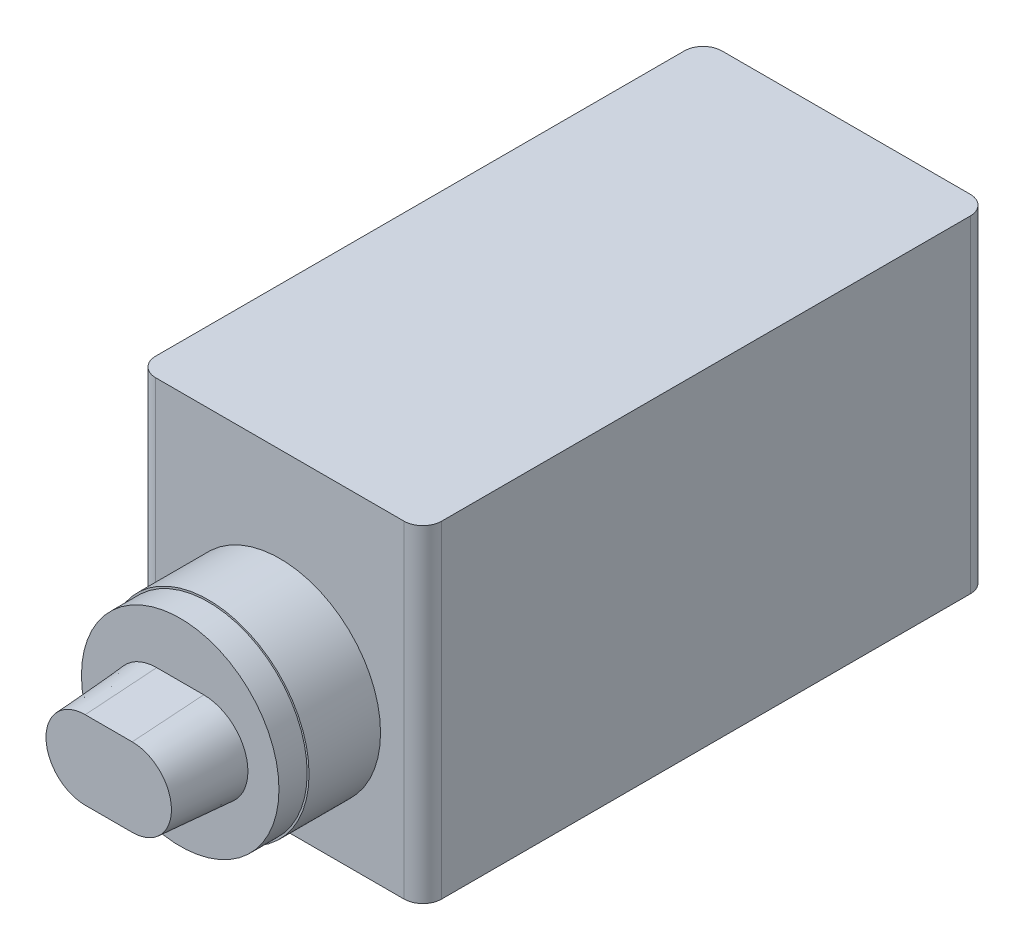
from build123d import *

# Parameters (mm, degrees)
SKETCH1_W           = 15.2
SKETCH1_H           = 30.1
BOSS_EXTRUDE1_DEPTH = 17.4
FILLET1_R           = 1
SKETCH3_R           = 5.35
BOSS_EXTRUDE2_DEPTH = 3.8
SKETCH4_R           = 5.25
BOSS_EXTRUDE3_DEPTH = 1.5
BOSS_EXTRUDE4_DEPTH = 3.8
BOSS_EXTRUDE4_TAPER = 4


with BuildPart() as part:
    # Sketch1 → Boss-Extrude1 (new body)
    with BuildSketch(Plane(origin=(0, 0, 0), x_dir=(1, 0, 0), z_dir=(0, 1, 0))):
        Rectangle(SKETCH1_W, SKETCH1_H)
    extrude(amount=BOSS_EXTRUDE1_DEPTH)

    # Fillet1
    fillet1_edges = [part.edges().sort_by_distance(p)[0] for p in [
        (-7.6, 8.7, -15.05),
        (7.6, 8.7, -15.05),
        (7.6, 8.7, 15.05),
        (-7.6, 8.7, 15.05),
    ]]
    fillet(fillet1_edges, radius=FILLET1_R)

    # Sketch3 → Boss-Extrude2 (add)
    with BuildSketch(Plane.XY.offset(15.05)):
        with Locations(Location((0, 7.030745518, 0), (0, 0, 180))):
            Circle(SKETCH3_R)
    extrude(amount=BOSS_EXTRUDE2_DEPTH)

    # Sketch4 → Boss-Extrude3 (add)
    with BuildSketch(Plane.XY.offset(18.85)):
        with Locations((0, 7.030745518)):
            Circle(SKETCH4_R)
    extrude(amount=BOSS_EXTRUDE3_DEPTH)

    # Sketch5 → Boss-Extrude4 (add)
    with BuildSketch(Plane.XY.offset(20.35)):
        with BuildLine():
            ThreePointArc((-1.25, 9.380745518), (-3.6, 7.030745518), (-1.25, 4.680745518))
            Line((-1.25, 4.680745518), (1.25, 4.680745518))
            ThreePointArc((1.25, 4.680745518), (3.6, 7.030745518), (1.25, 9.380745518))
            Line((1.25, 9.380745518), (-1.25, 9.380745518))
        make_face()
    extrude(amount=BOSS_EXTRUDE4_DEPTH, taper=BOSS_EXTRUDE4_TAPER)


solid = part.part
